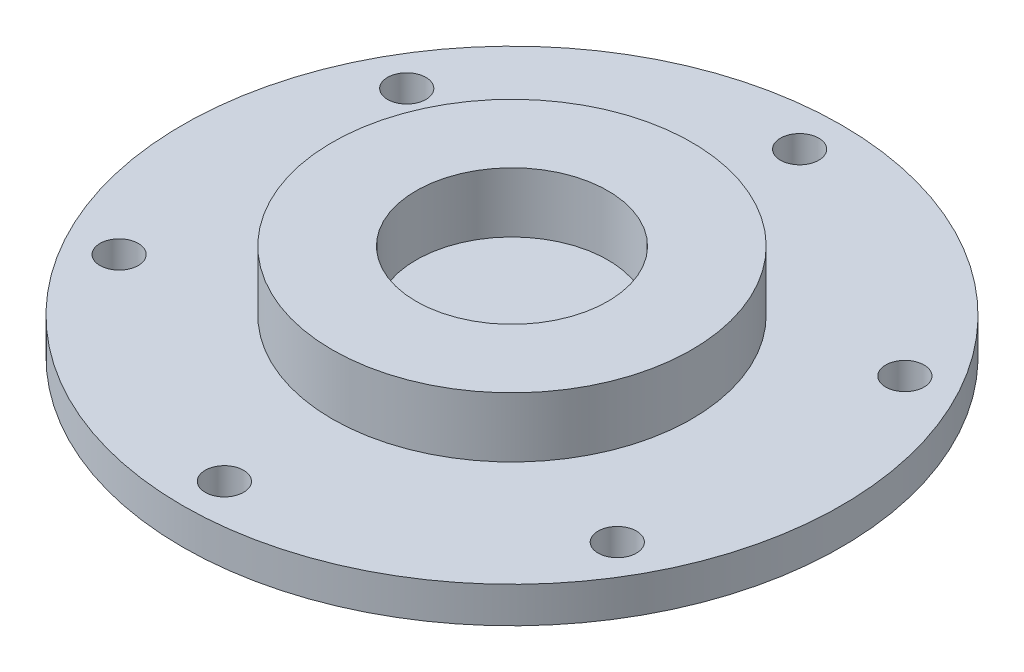
from build123d import *

# Parameters (mm, degrees)
SKETCH_1_R               = 27.5
EXTRUDE_1_DEPTH          = 3
SKETCH_2_R               = 15
EXTRUDE_2_DEPTH          = 5
CUT_EXTRUDE_1_REACH      = 41.211
SKETCH_4_R               = 1.6
PATTERN_CIRCULAR_1_COUNT = 6
SKETCH_5_R               = 8
CUT_EXTRUDE_2_DEPTH      = 5


with BuildPart() as part:
    # 草图1 → 凸台-拉伸1 (new body)
    with BuildSketch(Plane(origin=(0, 0, 0), x_dir=(1, 0, 0), z_dir=(0, 1, 0))):
        with Locations(Location((0, 0, 0), (0, 0, 270))):
            Circle(SKETCH_1_R)
    extrude(amount=EXTRUDE_1_DEPTH)

    # 草图2 → 凸台-拉伸2 (add)
    with BuildSketch(Plane(origin=(0, 3, 0), x_dir=(1, 0, 0), z_dir=(0, 1, 0))):
        with Locations(Location((0, 0, 0), (0, 0, 270))):
            Circle(SKETCH_2_R)
    extrude(amount=EXTRUDE_2_DEPTH)

    # 草图4 → 切除-拉伸1 (cut, up to next)
    with BuildSketch(Plane(origin=(0, 3, 0), x_dir=(1, 0, 0), z_dir=(0, 1, 0)), mode=Mode.PRIVATE) as cut_extrude_1_sk1:
        with Locations(Location((0, 24, 0), (0, 0, 270))):
            Circle(SKETCH_4_R)
    cut_extrude_1_tool1 = extrude(cut_extrude_1_sk1.sketch, amount=-CUT_EXTRUDE_1_REACH, mode=Mode.PRIVATE) & part.part
    cut_extrude_1 = cut_extrude_1_tool1.solids().sort_by_distance((0, 3, -24))[0]
    add(cut_extrude_1, mode=Mode.SUBTRACT)

    # 阵列(圆周)1: 切除-拉伸1 ×6 about axis
    pattern_circular_1_axis = Axis((0, 0, 0), (0, 1, 0))
    for i in range(1, PATTERN_CIRCULAR_1_COUNT):
        add(cut_extrude_1.rotate(pattern_circular_1_axis, i * 360 / PATTERN_CIRCULAR_1_COUNT), mode=Mode.SUBTRACT)

    # 草图5 → 切除-拉伸2 (cut)
    with BuildSketch(Plane(origin=(0, 8, 0), x_dir=(1, 0, 0), z_dir=(0, 1, 0))):
        with Locations(Location((0, 0, 0), (0, 0, 270))):
            Circle(SKETCH_5_R)
    extrude(amount=-CUT_EXTRUDE_2_DEPTH, mode=Mode.SUBTRACT)


solid = part.part
